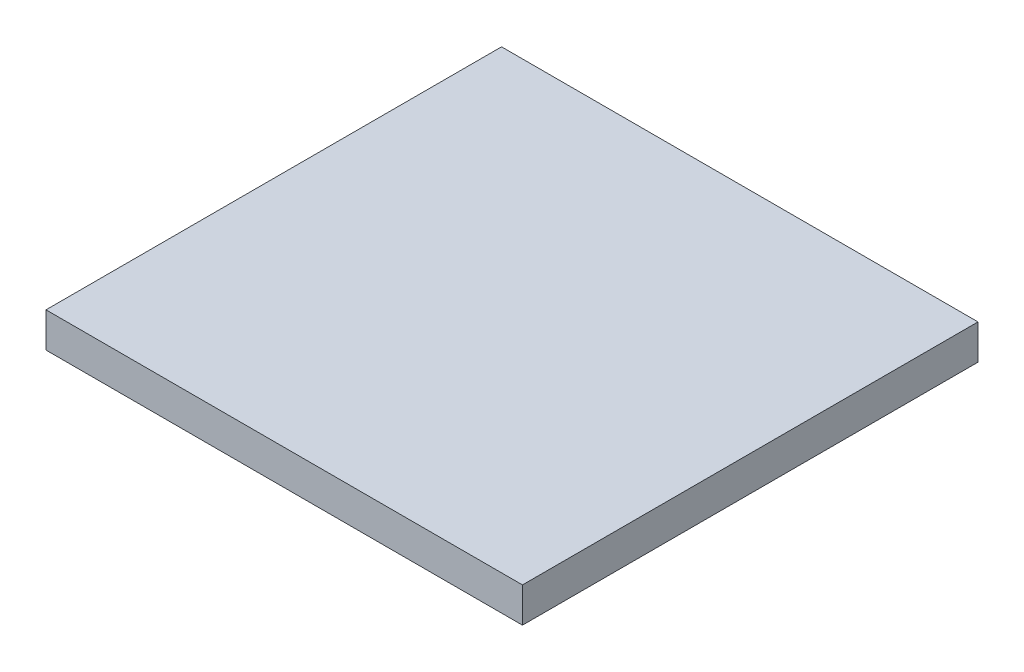
from build123d import *

# Parameters (mm, degrees)
CROQUIS1_W              = 68.3
CROQUIS1_H              = 65.3
SALIENTE_EXTRUIR1_DEPTH = 5


with BuildPart() as part:
    # Croquis1 → Saliente-Extruir1 (new body)
    with BuildSketch(Plane(origin=(0, 0, 0), x_dir=(1, 0, 0), z_dir=(0, 1, 0))):
        Rectangle(CROQUIS1_W, CROQUIS1_H)
    extrude(amount=SALIENTE_EXTRUIR1_DEPTH)


solid = part.part
